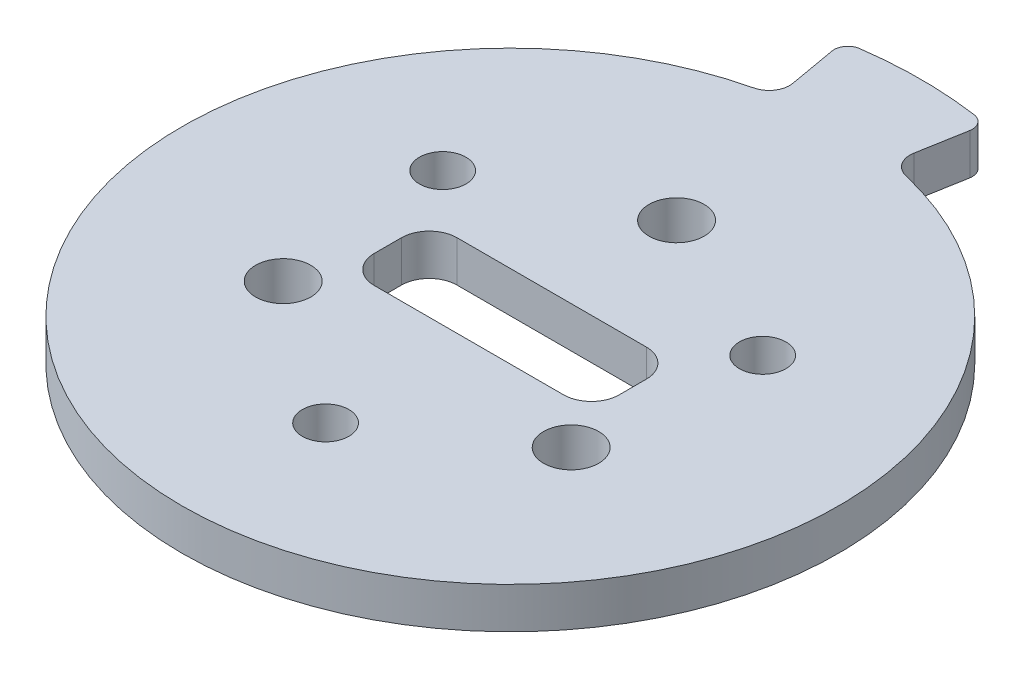
from build123d import *

# Parameters (mm, degrees)
SKETCH_1_R          = 30
EXTRUDE_1_DEPTH     = 3
SKETCH_2_R          = 1.7
SKETCH_2_R_2        = 2.015
CUT_EXTRUDE_1_DEPTH = 3
CUT_EXTRUDE_START   = -3
CUT_EXTRUDE_2_DEPTH = 3
FILLET_1_R          = 1.5
FILLET_2_R          = 1
SKETCH_4_W          = 17.9
SKETCH_4_H          = 6.05
CUT_EXTRUDE_3_DEPTH = 10
FILLET_3_R          = 2.03


with BuildPart() as part:
    # 草图1 → 凸台-拉伸1 (new body)
    with BuildSketch(Plane(origin=(0, 0, 0), x_dir=(1, 0, 0), z_dir=(0, 1, 0))):
        with Locations(Location((0, 0, 0), (0, 0, 270))):
            Circle(SKETCH_1_R)
    extrude(amount=EXTRUDE_1_DEPTH)

    # 草图2 → 切除-拉伸1 (cut)
    with BuildSketch(Plane(origin=(0, 3, 0), x_dir=(1, 0, 0), z_dir=(0, 1, 0))):
        with Locations(Location((0, -13.5, 0), (0, 0, 270))):
            Circle(SKETCH_2_R)
        with Locations(Location((-11.691342951, 6.75, 0), (0, 0, 270))):
            Circle(SKETCH_2_R)
        with Locations(Location((11.691342951, 6.75, 0), (0, 0, 270))):
            Circle(SKETCH_2_R)
        with Locations(Location((10.522208656, -6.075, 0), (0, 0, 270))):
            Circle(SKETCH_2_R_2)
        with Locations(Location((-10.522208656, -6.075, 0), (0, 0, 270))):
            Circle(SKETCH_2_R_2)
        with Locations(Location((0, 12.15, 0), (0, 0, 270))):
            Circle(SKETCH_2_R_2)
    extrude(amount=-CUT_EXTRUDE_1_DEPTH, mode=Mode.SUBTRACT)

    # 草图3 → 切除-拉伸2 (cut)
    with BuildSketch(Plane(origin=(0, 3, 0), x_dir=(1, 0, 0), z_dir=(0, 1, 0)).offset(CUT_EXTRUDE_START)):
        with BuildLine():
            Line((-5.20944533, 29.54423259), (-4.167556264, 23.635386072))
            ThreePointArc((-4.167556264, 23.635386072), (0, -24), (4.167556264, 23.635386072))
            Line((4.167556264, 23.635386072), (5.20944533, 29.54423259))
            ThreePointArc((5.20944533, 29.54423259), (0, -30), (-5.20944533, 29.54423259))
        make_face()
    extrude(amount=CUT_EXTRUDE_2_DEPTH, mode=Mode.SUBTRACT)

    # 圆角1
    fillet_1_edges = [part.edges().sort_by_distance(p)[0] for p in [
        (-4.167556264, 1.5, -23.635386072),
        (4.167556264, 1.5, -23.635386072),
    ]]
    fillet(fillet_1_edges, radius=FILLET_1_R)

    # 圆角2
    fillet_2_edges = [part.edges().sort_by_distance(p)[0] for p in [
        (5.20944533, 1.5, -29.54423259),
        (-5.20944533, 1.5, -29.54423259),
    ]]
    fillet(fillet_2_edges, radius=FILLET_2_R)

    # 草图4 → 切除-拉伸3 (cut)
    with BuildSketch(Plane(origin=(0, 3, 0), x_dir=(1, 0, 0), z_dir=(0, 1, 0))):
        Rectangle(SKETCH_4_W, SKETCH_4_H)
    extrude(amount=-CUT_EXTRUDE_3_DEPTH, mode=Mode.SUBTRACT)

    # 圆角3
    fillet_3_edges = [part.edges().sort_by_distance(p)[0] for p in [
        (8.95, 1.5, -3.025),
        (8.95, 1.5, 3.025),
        (-8.95, 1.5, 3.025),
        (-8.95, 1.5, -3.025),
    ]]
    fillet(fillet_3_edges, radius=FILLET_3_R)


solid = part.part
